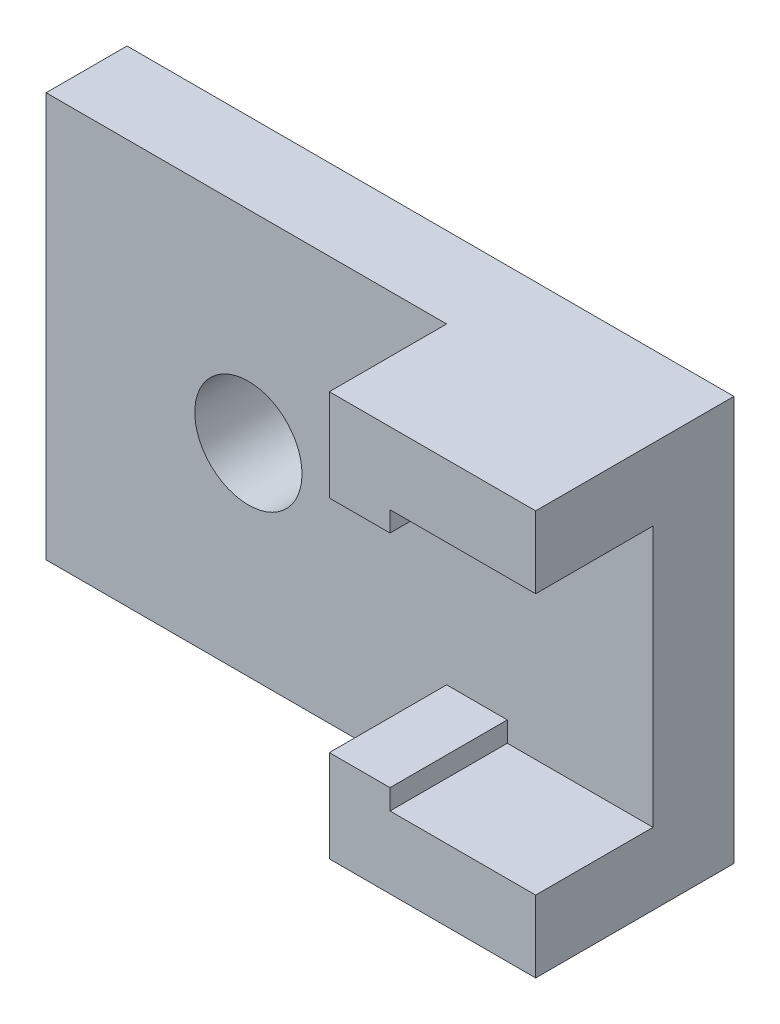
from build123d import *

# Parameters (mm, degrees)
SKETCH1_W           = 30
SKETCH1_H           = 20
BOSS_EXTRUDE1_DEPTH = 4
SKETCH2_R           = 2.65
CUT_EXTRUDE1_DEPTH  = 37.276714294
BOSS_EXTRUDE2_DEPTH = 5.8


with BuildPart() as part:
    # Sketch1 → Boss-Extrude1 (new body)
    with BuildSketch(Plane.XY):
        with Locations((15, -10)):
            Rectangle(SKETCH1_W, SKETCH1_H)
    extrude(amount=BOSS_EXTRUDE1_DEPTH)

    # Sketch2 → Cut-Extrude1 (cut, through all)
    with BuildSketch(Plane.XY.offset(4)):
        with Locations((10, -10)):
            Circle(SKETCH2_R)
    extrude(amount=-CUT_EXTRUDE1_DEPTH, mode=Mode.SUBTRACT)

    # Sketch3 → Boss-Extrude2 (add)
    with BuildSketch(Plane.XY.offset(4)):
        Polygon((22.8, -4.55), (22.8, -3.55), (22.8, 0), (19.8, 0), (19.8, -4.55), align=None)
        Polygon((22.8, 0), (22.8, -3.55), (29, -3.55), (30, -3.55), (30, 0), align=None)
        Polygon((22.8, -16.45), (22.8, -15.45), (19.8, -15.45), (19.8, -20), (22.8, -20), align=None)
        Polygon((30, -16.45), (29, -16.45), (22.8, -16.45), (22.8, -20), (30, -20), align=None)
    extrude(amount=BOSS_EXTRUDE2_DEPTH)


solid = part.part
